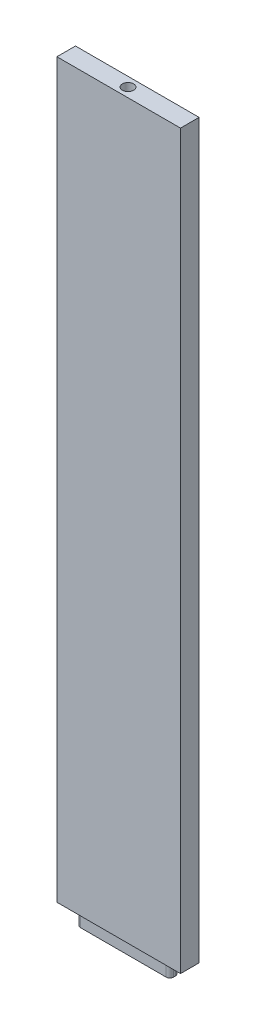
from build123d import *

# Parameters (mm, degrees)
CROQUIS1_W              = 33.25
CROQUIS1_H              = 197
SALIENTE_EXTRUIR1_DEPTH = 5
CROQUIS2_R              = 1.5
CORTAR_EXTRUIR1_DEPTH   = 15
CROQUIS3_W              = 25
CROQUIS3_H              = 2.5
SALIENTE_EXTRUIR2_DEPTH = 4
REDONDEO2_R             = 1


with BuildPart() as part:
    # Croquis1 → Saliente-Extruir1 (new body)
    with BuildSketch(Plane.XY):
        Rectangle(CROQUIS1_W, CROQUIS1_H)
    extrude(amount=SALIENTE_EXTRUIR1_DEPTH)

    # Croquis2 → Cortar-Extruir1 (cut)
    with BuildSketch(Plane(origin=(0, 98.5, 0), x_dir=(1, 0, 0), z_dir=(0, 1, 0))):
        with Locations(Location((0, -2.5, 0), (0, 0, 180))):
            Circle(CROQUIS2_R)
    extrude(amount=-CORTAR_EXTRUIR1_DEPTH, mode=Mode.SUBTRACT)

    # Croquis3 → Saliente-Extruir2 (add)
    with BuildSketch(Plane.XZ.offset(98.5)):
        with Locations((0, 2.5)):
            Rectangle(CROQUIS3_W, CROQUIS3_H)
    extrude(amount=SALIENTE_EXTRUIR2_DEPTH)

    # Redondeo2
    redondeo2_edges = [part.edges().sort_by_distance(p)[0] for p in [
        (-12.5, -100.5, 3.75),
        (-12.5, -100.5, 1.25),
        (12.5, -100.5, 1.25),
        (12.5, -100.5, 3.75),
    ]]
    fillet(redondeo2_edges, radius=REDONDEO2_R)


solid = part.part
